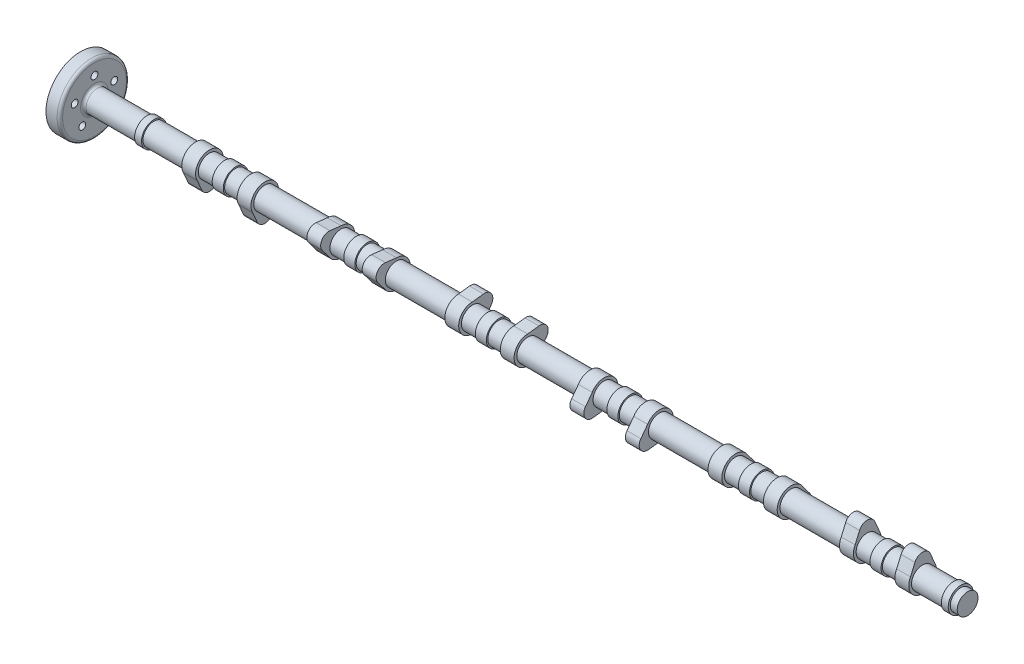
from build123d import *

# Parameters (mm, degrees)
SKETCH1_R             = 8
BOSS_EXTRUDE1_DEPTH   = 47.5
BOSS_EXTRUDE2_START   = 15
BOSS_EXTRUDE2_DEPTH   = 10
SKETCH3_R             = 9
BOSS_EXTRUDE3_DEPTH   = 4
LPATTERN1_COUNT       = 6
LPATTERN1_PITCH       = 95
BODY_MOVE_COPY1_ANGLE = 60
BODY_MOVE_COPY3_ANGLE = 120
BODY_MOVE_COPY4_ANGLE = 60
BODY_MOVE_COPY5_ANGLE = 120
BODY_MOVE_COPY6_ANGLE = 180
BOSS_EXTRUDE4_START   = 5
SKETCH4_R             = 9
BOSS_EXTRUDE4_DEPTH   = 5
SKETCH5_R             = 7.5
BOSS_EXTRUDE5_DEPTH   = 5
SKETCH6_R             = 8
BOSS_EXTRUDE6_DEPTH   = 7.5
SKETCH7_R             = 9
BOSS_EXTRUDE7_DEPTH   = 5
SKETCH8_R             = 8
BOSS_EXTRUDE8_DEPTH   = 38
SKETCH10_R            = 25
SKETCH10_R_2          = 2.5
BOSS_EXTRUDE9_DEPTH   = 10
SKETCH11_R            = 2.5
CUT_EXTRUDE1_DEPTH    = 15
FILLET1_R             = 2


with BuildPart() as part:
    # Sketch1 → Boss-Extrude1 (new, symmetric)
    with BuildSketch(Plane(origin=(0, 0, 0), x_dir=(0, 0, -1), z_dir=(1, 0, 0))):
        Circle(SKETCH1_R)
    extrude(amount=BOSS_EXTRUDE1_DEPTH, both=True)

    # Sketch2 → Boss-Extrude2 (add)
    with BuildSketch(Plane(origin=(0, 0, 0), x_dir=(0, 0, -1), z_dir=(1, 0, 0)).offset(BOSS_EXTRUDE2_START)):
        with BuildLine():
            Line((-8.746197071, -4.848096202), (-5.540743078, -12.343398625))
            ThreePointArc((-5.540743078, -12.343398625), (0, -16), (5.540743078, -12.343398625))
            Line((5.540743078, -12.343398625), (8.746197071, -4.848096202))
            ThreePointArc((8.746197071, -4.848096202), (0, 10), (-8.746197071, -4.848096202))
        make_face()
    boss_extrude2 = extrude(amount=BOSS_EXTRUDE2_DEPTH)

    # Mirror1: Boss-Extrude2 across plane
    add(boss_extrude2.mirror(Plane(origin=(0, 0, 0), x_dir=(0, 0, 1), z_dir=(1, 0, 0))))

    # Sketch3 → Boss-Extrude3 (add, symmetric)
    with BuildSketch(Plane(origin=(0, 0, 0), x_dir=(0, 0, -1), z_dir=(1, 0, 0))):
        Circle(SKETCH3_R)
    extrude(amount=BOSS_EXTRUDE3_DEPTH, both=True)


with BuildPart() as lpattern1_1:
    # LPattern1: pattern copy
    add(part.part.moved(Location(Vector(1, 0, 0) * (1 * LPATTERN1_PITCH))))


with BuildPart() as lpattern1_2:
    # LPattern1: pattern copy
    add(part.part.moved(Location(Vector(1, 0, 0) * (2 * LPATTERN1_PITCH))))


with BuildPart() as lpattern1_3:
    # LPattern1: pattern copy
    add(part.part.moved(Location(Vector(1, 0, 0) * (3 * LPATTERN1_PITCH))))


with BuildPart() as lpattern1_4:
    # LPattern1: pattern copy
    add(part.part.moved(Location(Vector(1, 0, 0) * (4 * LPATTERN1_PITCH))))


with BuildPart() as lpattern1_5:
    # LPattern1: pattern copy
    add(part.part.moved(Location(Vector(1, 0, 0) * (5 * LPATTERN1_PITCH))))


with BuildPart() as lpattern1_3_1:
    # Body-Move/Copy1: moved
    add(lpattern1_3.part.rotate(Axis((0, 0, 0), (-1, 0, 0)), BODY_MOVE_COPY1_ANGLE))


with BuildPart() as lpattern1_1_1:
    # Body-Move/Copy3: moved
    add(lpattern1_1.part.rotate(Axis((0, 0, 0), (-1, 0, 0)), BODY_MOVE_COPY3_ANGLE))


with BuildPart() as lpattern1_4_1:
    # Body-Move/Copy4: moved
    add(lpattern1_4.part.rotate(Axis((0, 0, 0), (1, 0, 0)), BODY_MOVE_COPY4_ANGLE))


with BuildPart() as lpattern1_2_1:
    # Body-Move/Copy5: moved
    add(lpattern1_2.part.rotate(Axis((0, 0, 0), (1, 0, 0)), BODY_MOVE_COPY5_ANGLE))


with BuildPart() as lpattern1_5_1:
    # Body-Move/Copy6: moved
    add(lpattern1_5.part.rotate(Axis((0, 0, 0), (1, 0, 0)), BODY_MOVE_COPY6_ANGLE))

    # Sketch4 → Boss-Extrude4 (add)
    with BuildSketch(Plane(origin=(522.5, 0, 0), x_dir=(0, 0, -1), z_dir=(1, 0, 0)).offset(BOSS_EXTRUDE4_START)):
        Circle(SKETCH4_R)
    extrude(amount=-BOSS_EXTRUDE4_DEPTH)

    # Combine1: union LPattern1_3, LPattern1_4, LPattern1_2, LPattern1_1, part
    add(lpattern1_3_1.part)
    add(lpattern1_4_1.part)
    add(lpattern1_2_1.part)
    add(lpattern1_1_1.part)
    add(part.part)

    # Sketch5 → Boss-Extrude5 (add)
    with BuildSketch(Plane(origin=(527.5, 0, 0), x_dir=(0, 0, -1), z_dir=(1, 0, 0))):
        Circle(SKETCH5_R)
    extrude(amount=BOSS_EXTRUDE5_DEPTH)

    # Sketch6 → Boss-Extrude6 (add)
    with BuildSketch(Plane.ZY.offset(47.5)):
        Circle(SKETCH6_R)
    extrude(amount=BOSS_EXTRUDE6_DEPTH)

    # Sketch7 → Boss-Extrude7 (add)
    with BuildSketch(Plane.ZY.offset(55)):
        Circle(SKETCH7_R)
    extrude(amount=BOSS_EXTRUDE7_DEPTH)

    # Sketch8 → Boss-Extrude8 (add)
    with BuildSketch(Plane.ZY.offset(60)):
        Circle(SKETCH8_R)
    extrude(amount=BOSS_EXTRUDE8_DEPTH)

    # Sketch10 → Boss-Extrude9 (add)
    with BuildSketch(Plane.ZY.offset(98)):
        Circle(SKETCH10_R)
        Circle(SKETCH10_R_2, mode=Mode.SUBTRACT)
    extrude(amount=BOSS_EXTRUDE9_DEPTH)

    # Sketch11 → Cut-Extrude1 (cut)
    with BuildSketch(Plane.ZY.offset(108)):
        Circle(SKETCH11_R)
        with Locations((0, 15)):
            Circle(SKETCH11_R)
        with Locations((14.265847744, 4.635254916)):
            Circle(SKETCH11_R)
        with Locations((8.816778784, -12.135254916)):
            Circle(SKETCH11_R)
        with Locations((-8.816778784, -12.135254916)):
            Circle(SKETCH11_R)
        with Locations((-14.265847744, 4.635254916)):
            Circle(SKETCH11_R)
    extrude(amount=-CUT_EXTRUDE1_DEPTH, mode=Mode.SUBTRACT)

    # Fillet1
    fillet1_edges = [lpattern1_5_1.edges().sort_by_distance(p)[0] for p in [
        (-98, 0, -8),
        (-98, 0, -25),
    ]]
    fillet(fillet1_edges, radius=FILLET1_R)


solid = lpattern1_5_1.part
